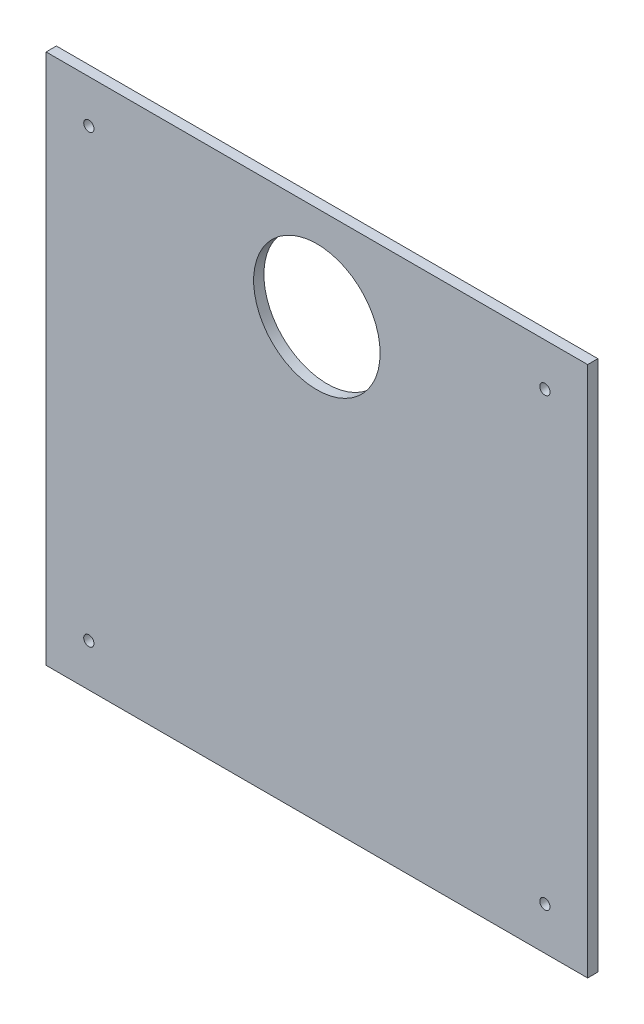
from build123d import *

# Parameters (mm, degrees)
SKETCH1_W           = 316.8
SKETCH1_H           = 457.2
BOSS_EXTRUDE1_DEPTH = 6
SKETCH2_R           = 37
CUT_EXTRUDE1_DEPTH  = 279.180732618
SKETCH3_W           = 316.8
SKETCH3_H           = 146.4
CUT_EXTRUDE2_DEPTH  = 279.180732618
SKETCH4_R           = 3
CUT_EXTRUDE3_DEPTH  = 279.180732618


with BuildPart() as part:
    # Sketch1 → Boss-Extrude1 (new body)
    with BuildSketch(Plane.XY):
        Rectangle(SKETCH1_W, SKETCH1_H)
    extrude(amount=BOSS_EXTRUDE1_DEPTH)

    # Sketch2 → Cut-Extrude1 (cut, through all)
    with BuildSketch(Plane.XY.offset(6)):
        with Locations((0, 173.6)):
            Circle(SKETCH2_R)
    extrude(amount=-CUT_EXTRUDE1_DEPTH, mode=Mode.SUBTRACT)

    # Sketch3 → Cut-Extrude2 (cut, through all)
    with BuildSketch(Plane.XY.offset(6)):
        with Locations((0, -155.4)):
            Rectangle(SKETCH3_W, SKETCH3_H)
    extrude(amount=-CUT_EXTRUDE2_DEPTH, mode=Mode.SUBTRACT)

    # Sketch4 → Cut-Extrude3 (cut, through all)
    with BuildSketch(Plane.XY.offset(6)):
        with Locations((-133.4, 203.6)):
            Circle(SKETCH4_R)
        with Locations((-133.4, -57.2)):
            Circle(SKETCH4_R)
        with Locations((133.4, -57.2)):
            Circle(SKETCH4_R)
        with Locations((133.4, 203.6)):
            Circle(SKETCH4_R)
    extrude(amount=-CUT_EXTRUDE3_DEPTH, mode=Mode.SUBTRACT)


solid = part.part
